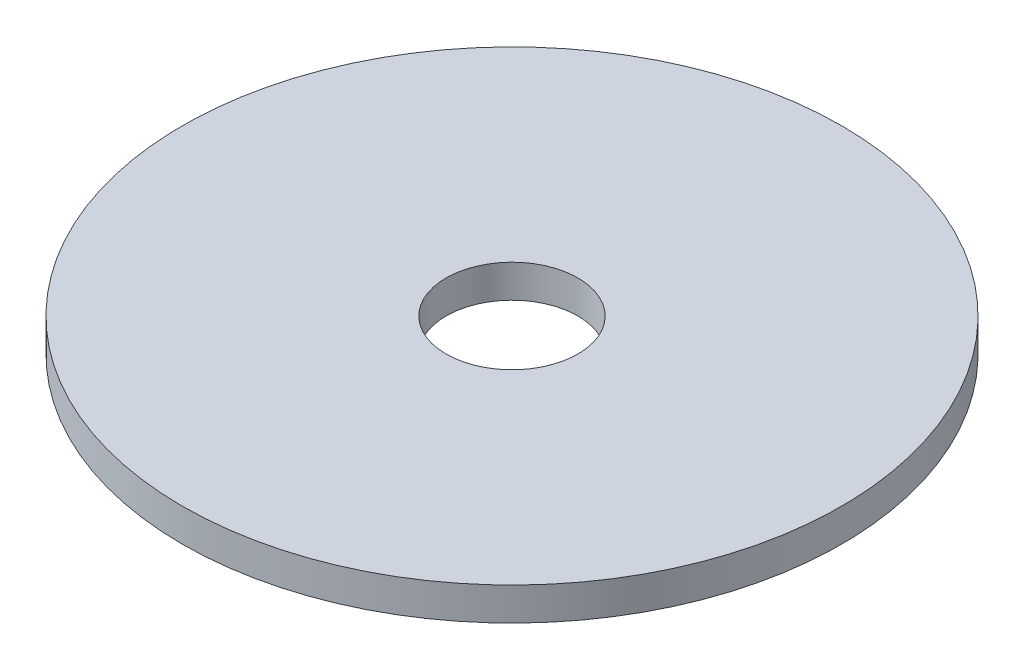
from build123d import *

# Parameters (mm, degrees)
SKETCH1_R           = 50
BOSS_EXTRUDE1_DEPTH = 5
SKETCH2_R           = 10
CUT_EXTRUDE1_DEPTH  = 5


with BuildPart() as part:
    # Sketch1 → Boss-Extrude1 (new body)
    with BuildSketch(Plane(origin=(0, 0, 0), x_dir=(1, 0, 0), z_dir=(0, 1, 0))):
        with Locations(Location((0, 0, 0), (0, 0, 270))):
            Circle(SKETCH1_R)
    extrude(amount=BOSS_EXTRUDE1_DEPTH)

    # Sketch2 → Cut-Extrude1 (cut)
    with BuildSketch(Plane(origin=(0, 5, 0), x_dir=(1, 0, 0), z_dir=(0, 1, 0))):
        with Locations(Location((0, 0, 0), (0, 0, 270))):
            Circle(SKETCH2_R)
    extrude(amount=-CUT_EXTRUDE1_DEPTH, mode=Mode.SUBTRACT)


solid = part.part
